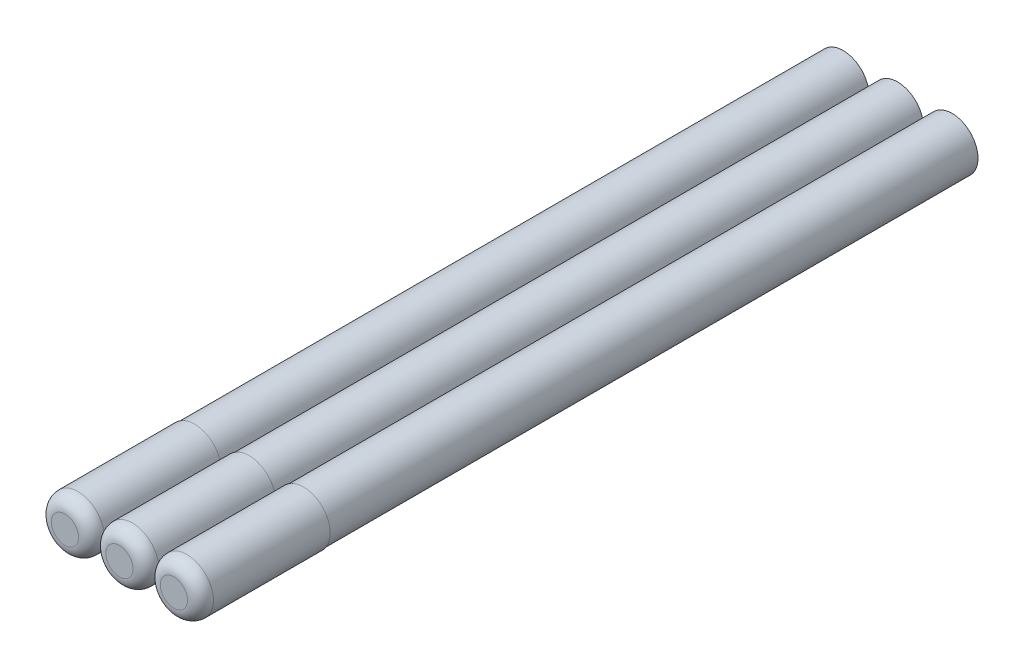
from build123d import *

# Parameters (mm, degrees)
SKETCH_1_R        = 2
EXTRUDE_1_DEPTH   = 50
EXTRUDE_1_2_DEPTH = 50
EXTRUDE_1_3_DEPTH = 50
SKETCH_2_R        = 2.05
EXTRUDE_2_DEPTH   = 10
EXTRUDE_2_2_DEPTH = 10
EXTRUDE_2_3_DEPTH = 10
FILLET_1_R        = 1
FILLET_2_R        = 1
FILLET_3_R        = 1


with BuildPart() as part:
    # Эскиз1 → Бобышка-Вытянуть1 (new body)
    with BuildSketch(Plane.XY):
        Circle(SKETCH_1_R)
    extrude(amount=EXTRUDE_1_DEPTH)


with BuildPart() as body_2:
    # Эскиз1 → Extrude 1 2 (new body)
    with BuildSketch(Plane.XY):
        with Locations((4.2, 0)):
            Circle(SKETCH_1_R)
    extrude(amount=EXTRUDE_1_2_DEPTH)


with BuildPart() as body_3:
    # Эскиз1 → Extrude 1 3 (new body)
    with BuildSketch(Plane.XY):
        with Locations((-4.2, 0)):
            Circle(SKETCH_1_R)
    extrude(amount=EXTRUDE_1_3_DEPTH)


with BuildPart() as body_4:
    # Эскиз2 → Бобышка-Вытянуть2 (new body)
    with BuildSketch(Plane.XY.offset(50)):
        Circle(SKETCH_2_R)
    extrude(amount=EXTRUDE_2_DEPTH)

    # Скругление2
    fillet_2_edges = [body_4.edges().sort_by_distance(p)[0] for p in [
        (-2.05, 0, 60),
    ]]
    fillet(fillet_2_edges, radius=FILLET_2_R)


with BuildPart() as body_5:
    # Эскиз2 → Extrude 2 2 (new body)
    with BuildSketch(Plane.XY.offset(50)):
        with Locations((4.2, 0)):
            Circle(SKETCH_2_R)
    extrude(amount=EXTRUDE_2_2_DEPTH)

    # Скругление3
    fillet_3_edges = [body_5.edges().sort_by_distance(p)[0] for p in [
        (2.15, 0, 60),
    ]]
    fillet(fillet_3_edges, radius=FILLET_3_R)


with BuildPart() as body_6:
    # Эскиз2 → Extrude 2 3 (new body)
    with BuildSketch(Plane.XY.offset(50)):
        with Locations((-4.2, 0)):
            Circle(SKETCH_2_R)
    extrude(amount=EXTRUDE_2_3_DEPTH)

    # Скругление1
    fillet_1_edges = [body_6.edges().sort_by_distance(p)[0] for p in [
        (-6.25, 0, 60),
    ]]
    fillet(fillet_1_edges, radius=FILLET_1_R)


solid = Compound([part.part, body_2.part, body_3.part, body_4.part, body_5.part, body_6.part])
